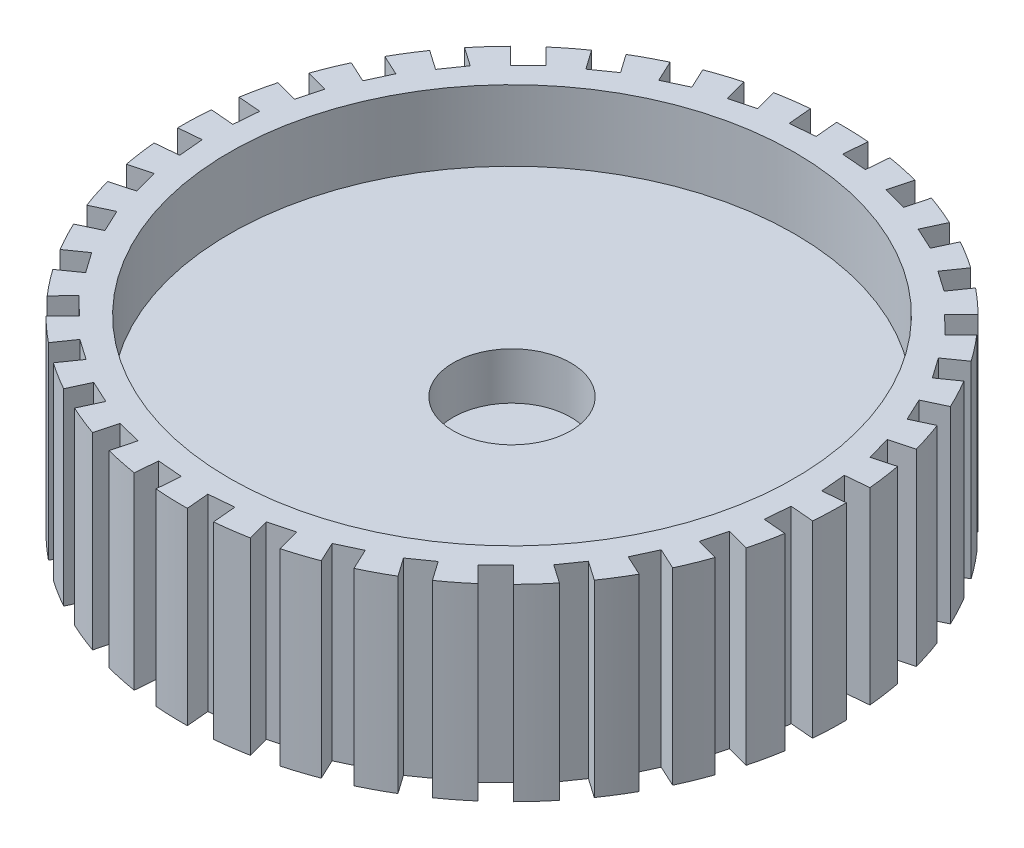
from build123d import *

# Parameters (mm, degrees)
SKETCH_1_R          = 13
EXTRUDE_1_DEPTH     = 8
SKETCH_6_R          = 14
EXTRUDE_4_DEPTH     = 8
SKETCH_2_R          = 12
CUT_EXTRUDE_1_DEPTH = 3
CUT_EXTRUDE_2_DEPTH = 22.354156504
SKETCH_8_R          = 2.5
CUT_EXTRUDE_3_DEPTH = 2


with BuildPart() as part:
    # 草图1 → 凸台-拉伸1 (new body)
    with BuildSketch(Plane(origin=(0, 0, 0), x_dir=(1, 0, 0), z_dir=(0, 1, 0))):
        with Locations(Location((0, 0, 0), (0, 0, 270))):
            Circle(SKETCH_1_R)
    extrude(amount=EXTRUDE_1_DEPTH)

    # 草图6 → 凸台-拉伸4 (add, through all)
    with BuildSketch(Plane(origin=(0, 8, 0), x_dir=(1, 0, 0), z_dir=(0, 1, 0))):
        with Locations(Location((0, 0, 0), (0, 0, 270))):
            Circle(SKETCH_6_R)
    extrude(amount=-EXTRUDE_4_DEPTH)

    # 草图2 → 切除-拉伸1 (cut)
    with BuildSketch(Plane(origin=(0, 8, 0), x_dir=(1, 0, 0), z_dir=(0, 1, 0))):
        with Locations(Location((0, 0, 0), (0, 0, 270))):
            Circle(SKETCH_2_R)
    extrude(amount=-CUT_EXTRUDE_1_DEPTH, mode=Mode.SUBTRACT)

    # 草图7 → 切除-拉伸2 (cut, through all)
    with BuildSketch(Plane(origin=(0, 8, 0), x_dir=(1, 0, 0), z_dir=(0, 1, 0))):
        Polygon((-15.646830527, 4.142221687), (-12.567085782, 3.326913727), (-12.296421758, 4.349320163), (-15.376166503, 5.164628122), align=None)
        Polygon((-14.689830765, 6.79633564), (-11.798451005, 5.458621977), (-11.354359961, 6.418495447), (-14.245739722, 7.756209109), align=None)
        Polygon((-13.28648793, 9.243946373), (-10.671326264, 7.42447276), (-10.067301683, 8.292647994), (-12.682463348, 10.112121607), align=None)
        Polygon((-11.479441881, 11.410684473), (-9.219958675, 9.164734695), (-8.474353537, 9.914832629), (-10.733836743, 12.160782407), align=None)
        Polygon((-9.3235988, 13.230714699), (-7.488447307, 10.626530804), (-6.623916447, 11.235760092), (-8.45906794, 13.839943987), align=None)
        Polygon((-6.884462888, 14.648736355), (-5.529403257, 11.765445152), (-4.572215008, 12.215294669), (-5.927274639, 15.098585872), align=None)
        Polygon((-4.236146054, 15.621663569), (-3.402351087, 12.546872402), (-2.381589129, 12.8236737), (-3.215384096, 15.898464866), align=None)
        Polygon((-1.459116066, 16.11993444), (-1.171920201, 12.947069284), (-0.11859987, 13.042411894), (-0.405795735, 16.21527705), align=None)
        Polygon((1.362248425, 16.12840926), (1.094118888, 12.953876017), (2.147992986, 12.864863002), (2.416122524, 16.039396246), align=None)
        Polygon((4.142221687, 15.646830527), (3.326913727, 12.567085782), (4.349320163, 12.296421758), (5.164628122, 15.376166503), align=None)
        Polygon((6.79633564, 14.689830765), (5.458621977, 11.798451005), (6.418495447, 11.354359961), (7.756209109, 14.245739722), align=None)
        Polygon((9.243946373, 13.28648793), (7.42447276, 10.671326264), (8.292647994, 10.067301683), (10.112121607, 12.682463348), align=None)
        Polygon((11.410684473, 11.479441881), (9.164734695, 9.219958675), (9.914832629, 8.474353537), (12.160782407, 10.733836743), align=None)
        Polygon((13.230714699, 9.3235988), (10.626530804, 7.488447307), (11.235760092, 6.623916447), (13.839943987, 8.45906794), align=None)
        Polygon((14.648736355, 6.884462888), (11.765445152, 5.529403257), (12.215294669, 4.572215008), (15.098585872, 5.927274639), align=None)
        Polygon((15.621663569, 4.236146054), (12.546872402, 3.402351087), (12.8236737, 2.381589129), (15.898464866, 3.215384096), align=None)
        Polygon((16.11993444, 1.459116066), (12.947069284, 1.171920201), (13.042411894, 0.11859987), (16.21527705, 0.405795735), align=None)
        Polygon((16.12840926, -1.362248425), (12.953876017, -1.094118888), (12.864863002, -2.147992986), (16.039396246, -2.416122524), align=None)
        Polygon((15.646830527, -4.142221687), (12.567085782, -3.326913727), (12.296421758, -4.349320163), (15.376166503, -5.164628122), align=None)
        Polygon((14.689830765, -6.79633564), (11.798451005, -5.458621977), (11.354359961, -6.418495447), (14.245739722, -7.756209109), align=None)
        Polygon((13.28648793, -9.243946373), (10.671326264, -7.42447276), (10.067301683, -8.292647994), (12.682463348, -10.112121607), align=None)
        Polygon((11.479441881, -11.410684473), (9.219958675, -9.164734695), (8.474353537, -9.914832629), (10.733836743, -12.160782407), align=None)
        Polygon((9.3235988, -13.230714699), (7.488447307, -10.626530804), (6.623916447, -11.235760092), (8.45906794, -13.839943987), align=None)
        Polygon((6.884462888, -14.648736355), (5.529403257, -11.765445152), (4.572215008, -12.215294669), (5.927274639, -15.098585872), align=None)
        Polygon((4.236146054, -15.621663569), (3.402351087, -12.546872402), (2.381589129, -12.8236737), (3.215384096, -15.898464866), align=None)
        Polygon((1.459116066, -16.11993444), (1.171920201, -12.947069284), (0.11859987, -13.042411894), (0.405795735, -16.21527705), align=None)
        Polygon((-1.362248425, -16.12840926), (-1.094118888, -12.953876017), (-2.147992986, -12.864863002), (-2.416122524, -16.039396246), align=None)
        Polygon((-4.142221687, -15.646830527), (-3.326913727, -12.567085782), (-4.349320163, -12.296421758), (-5.164628122, -15.376166503), align=None)
        Polygon((-6.79633564, -14.689830765), (-5.458621977, -11.798451005), (-6.418495447, -11.354359961), (-7.756209109, -14.245739722), align=None)
        Polygon((-9.243946373, -13.28648793), (-7.42447276, -10.671326264), (-8.292647994, -10.067301683), (-10.112121607, -12.682463348), align=None)
        Polygon((-11.410684473, -11.479441881), (-9.164734695, -9.219958675), (-9.914832629, -8.474353537), (-12.160782407, -10.733836743), align=None)
        Polygon((-13.230714699, -9.3235988), (-10.626530804, -7.488447307), (-11.235760092, -6.623916447), (-13.839943987, -8.45906794), align=None)
        Polygon((-14.648736355, -6.884462888), (-11.765445152, -5.529403257), (-12.215294669, -4.572215008), (-15.098585872, -5.927274639), align=None)
        Polygon((-15.621663569, -4.236146054), (-12.546872402, -3.402351087), (-12.8236737, -2.381589129), (-15.898464866, -3.215384096), align=None)
        Polygon((-16.11993444, -1.459116066), (-12.947069284, -1.171920201), (-13.042411894, -0.11859987), (-16.21527705, -0.405795735), align=None)
        Polygon((-16.12840926, 1.362248425), (-12.953876017, 1.094118888), (-12.864863002, 2.147992986), (-16.039396246, 2.416122524), align=None)
    extrude(amount=-CUT_EXTRUDE_2_DEPTH, mode=Mode.SUBTRACT)

    # 草图8 → 切除-拉伸3 (cut)
    with BuildSketch(Plane(origin=(0, 5, 0), x_dir=(1, 0, 0), z_dir=(0, 1, 0))):
        with Locations(Location((0, 0, 0), (0, 0, 270))):
            Circle(SKETCH_8_R)
    extrude(amount=-CUT_EXTRUDE_3_DEPTH, mode=Mode.SUBTRACT)


solid = part.part
